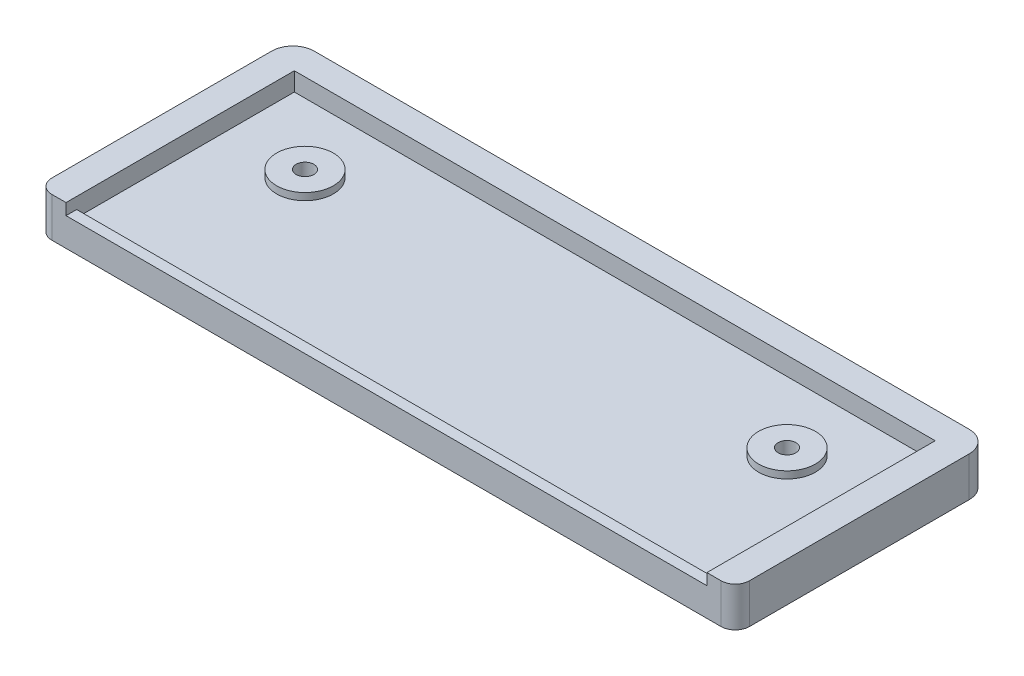
from build123d import *

# Parameters (mm, degrees)
SKETCH1_W           = 89.98
SKETCH1_H           = 32
SKETCH1_R           = 4
SKETCH1_R_2         = 1.25
BOSS_EXTRUDE1_DEPTH = 3
BOSS_EXTRUDE2_START = 3
SKETCH1_5_R         = 4
SKETCH1_5_R_2       = 1.25
BOSS_EXTRUDE2_DEPTH = 1
BOSS_EXTRUDE3_START = 4
BOSS_EXTRUDE3_DEPTH = 1.6
SKETCH2_W           = 90.38
SKETCH2_H           = 1.5
BOSS_EXTRUDE4_DEPTH = 1


with BuildPart() as part:
    # Sketch1 → Boss-Extrude1 (new body)
    # profile 1 of 5: a face of its own
    with BuildSketch(Plane(origin=(0, 0, 0), x_dir=(1, 0, 0), z_dir=(0, 1, 0))):
        with Locations((44.99, -16)):
            Rectangle(SKETCH1_W, SKETCH1_H)
        with Locations((78.98, -9.5)):
            Circle(SKETCH1_R, mode=Mode.SUBTRACT)
        with Locations((11, -9.5)):
            Circle(SKETCH1_R, mode=Mode.SUBTRACT)
    # profile 2 of 5: a face of its own
    with BuildSketch(Plane(origin=(0, 0, 0), x_dir=(1, 0, 0), z_dir=(0, 1, 0))):
        with Locations((11, -9.5)):
            Circle(SKETCH1_R)
        with Locations(Location((11, -9.5, 0), (0, 0, 270))):
            Circle(SKETCH1_R_2, mode=Mode.SUBTRACT)
    # profile 3 of 5: a face of its own
    with BuildSketch(Plane(origin=(0, 0, 0), x_dir=(1, 0, 0), z_dir=(0, 1, 0))):
        Polygon((90.18, -32), (89.98, -32), (89.98, 0), (0, 0), (0, -32), (-0.2, -32), (-0.2, 0.2), (90.18, 0.2), align=None)
    # profile 4 of 5: a face of its own
    with BuildSketch(Plane(origin=(0, 0, 0), x_dir=(1, 0, 0), z_dir=(0, 1, 0))):
        with BuildLine():
            ThreePointArc((-2.2, -32), (-3.614213562, -31.414213562), (-4.2, -30))
            Line((-4.2, -30), (-4.2, 1))
            ThreePointArc((-4.2, 1), (-3.321320344, 3.121320344), (-1.2, 4))
            Line((-1.2, 4), (91.18, 4))
            ThreePointArc((91.18, 4), (93.301320344, 3.121320344), (94.18, 1))
            Line((94.18, 1), (94.18, -30))
            ThreePointArc((94.18, -30), (93.594213562, -31.414213562), (92.18, -32))
            Line((92.18, -32), (90.18, -32))
            Line((90.18, -32), (90.18, 0.2))
            Line((90.18, 0.2), (-0.2, 0.2))
            Line((-0.2, 0.2), (-0.2, -32))
            Line((-0.2, -32), (-2.2, -32))
        make_face()
    # profile 5 of 5: a face of its own
    with BuildSketch(Plane(origin=(0, 0, 0), x_dir=(1, 0, 0), z_dir=(0, 1, 0))):
        with Locations((78.98, -9.5)):
            Circle(SKETCH1_R)
        with Locations(Location((78.98, -9.5, 0), (0, 0, 270))):
            Circle(SKETCH1_R_2, mode=Mode.SUBTRACT)
    extrude(amount=BOSS_EXTRUDE1_DEPTH)

    # Sketch1<5> → Boss-Extrude2 (add)
    # profile 1 of 3: a face of its own
    with BuildSketch(Plane(origin=(0, 0, 0), x_dir=(1, 0, 0), z_dir=(0, 1, 0)).offset(BOSS_EXTRUDE2_START)):
        with Locations(Location((11, -9.5, 0), (0, 0, 270))):
            Circle(SKETCH1_5_R)
        with Locations(Location((11, -9.5, 0), (0, 0, 270))):
            Circle(SKETCH1_5_R_2, mode=Mode.SUBTRACT)
    # profile 2 of 3: a face of its own
    with BuildSketch(Plane(origin=(0, 0, 0), x_dir=(1, 0, 0), z_dir=(0, 1, 0)).offset(BOSS_EXTRUDE2_START)):
        with BuildLine():
            ThreePointArc((-2.2, -32), (-3.614213562, -31.414213562), (-4.2, -30))
            Line((-4.2, -30), (-4.2, 1))
            ThreePointArc((-4.2, 1), (-3.321320344, 3.121320344), (-1.2, 4))
            Line((-1.2, 4), (91.18, 4))
            ThreePointArc((91.18, 4), (93.301320344, 3.121320344), (94.18, 1))
            Line((94.18, 1), (94.18, -30))
            ThreePointArc((94.18, -30), (93.594213562, -31.414213562), (92.18, -32))
            Line((92.18, -32), (90.18, -32))
            Line((90.18, -32), (90.18, 0.2))
            Line((90.18, 0.2), (-0.2, 0.2))
            Line((-0.2, 0.2), (-0.2, -32))
            Line((-0.2, -32), (-2.2, -32))
        make_face()
    # profile 3 of 3: a face of its own
    with BuildSketch(Plane(origin=(0, 0, 0), x_dir=(1, 0, 0), z_dir=(0, 1, 0)).offset(BOSS_EXTRUDE2_START)):
        with Locations(Location((78.98, -9.5, 0), (0, 0, 270))):
            Circle(SKETCH1_5_R)
        with Locations(Location((78.98, -9.5, 0), (0, 0, 270))):
            Circle(SKETCH1_5_R_2, mode=Mode.SUBTRACT)
    extrude(amount=BOSS_EXTRUDE2_DEPTH)

    # Sketch1<6> → Boss-Extrude3 (add)
    with BuildSketch(Plane(origin=(0, 0, 0), x_dir=(1, 0, 0), z_dir=(0, 1, 0)).offset(BOSS_EXTRUDE3_START)):
        with BuildLine():
            ThreePointArc((-2.2, -32), (-3.614213562, -31.414213562), (-4.2, -30))
            Line((-4.2, -30), (-4.2, 1))
            ThreePointArc((-4.2, 1), (-3.321320344, 3.121320344), (-1.2, 4))
            Line((-1.2, 4), (91.18, 4))
            ThreePointArc((91.18, 4), (93.301320344, 3.121320344), (94.18, 1))
            Line((94.18, 1), (94.18, -30))
            ThreePointArc((94.18, -30), (93.594213562, -31.414213562), (92.18, -32))
            Line((92.18, -32), (90.18, -32))
            Line((90.18, -32), (90.18, 0.2))
            Line((90.18, 0.2), (-0.2, 0.2))
            Line((-0.2, 0.2), (-0.2, -32))
            Line((-0.2, -32), (-2.2, -32))
        make_face()
    extrude(amount=BOSS_EXTRUDE3_DEPTH)

    # Sketch2 → Boss-Extrude4 (add)
    with BuildSketch(Plane(origin=(0, 3, 0), x_dir=(1, 0, 0), z_dir=(0, 1, 0))):
        with Locations((44.99, -31.25)):
            Rectangle(SKETCH2_W, SKETCH2_H)
    extrude(amount=BOSS_EXTRUDE4_DEPTH)


solid = part.part
